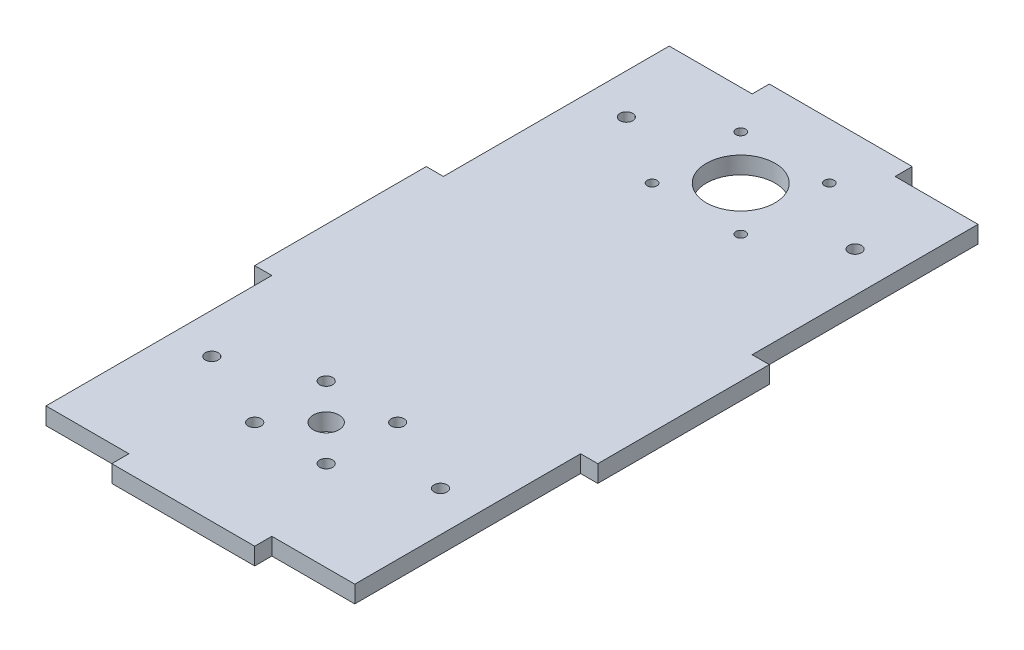
from build123d import *

# Parameters (mm, degrees)
CROQUIS1_R                   = 4.5
CROQUIS1_R_2                 = 12
SALIENTE_EXTRUIR1_DEPTH      = 3
TALADRO_DE_MARGEN_PARA_M41_D = 4.5
TALADRO_DE_MARGEN_PARA_M42_D = 4.5
TALADRO_DE_MARGEN_PARA_M32_D = 3.4


with BuildPart() as part:
    # Croquis1 → Saliente-Extruir1 (new, symmetric)
    with BuildSketch(Plane(origin=(0, 0, 0), x_dir=(1, 0, 0), z_dir=(0, 1, 0))):
        Polygon((-54, -109), (-25, -109), (-25, -115), (25, -115), (25, -109), (54, -109), (54, -30), (60, -30), (60, 30), (54, 30), (54, 109), (25, 109), (25, 115), (-25, 115), (-25, 109), (-54, 109), (-54, 30), (-60, 30), (-60, -30), (-54, -30), align=None)
        with Locations(Location((0, -65, 0), (0, 0, 270))):
            Circle(CROQUIS1_R, mode=Mode.SUBTRACT)
        with Locations(Location((0, 80, 0), (0, 0, 270))):
            Circle(CROQUIS1_R_2, mode=Mode.SUBTRACT)
    extrude(amount=SALIENTE_EXTRUIR1_DEPTH, both=True)

    # Taladro de margen para M41 (through all)
    with Locations(Plane(origin=(0, 3, 0), x_dir=(1, 0, 0), z_dir=(0, 1, 0))):
        with Locations((-12.5, -77.5), (-12.5, -52.5), (12.5, -52.5), (12.5, -77.5)):
            Hole(TALADRO_DE_MARGEN_PARA_M41_D / 2)

    # Taladro de margen para M42 (through all)
    with Locations(Plane(origin=(0, 3, 0), x_dir=(1, 0, 0), z_dir=(0, 1, 0))):
        with Locations((-40, 80), (-40, -65), (40, -65), (40, 80)):
            Hole(TALADRO_DE_MARGEN_PARA_M42_D / 2)

    # Taladro de margen para M32 (through all)
    with Locations(Plane(origin=(0, -3, 0), x_dir=(-1, 0, 0), z_dir=(0, -1, 0))):
        with Locations((-15.5, 64.5), (-15.5, 95.5), (15.5, 95.5), (15.5, 64.5)):
            Hole(TALADRO_DE_MARGEN_PARA_M32_D / 2)


solid = part.part
